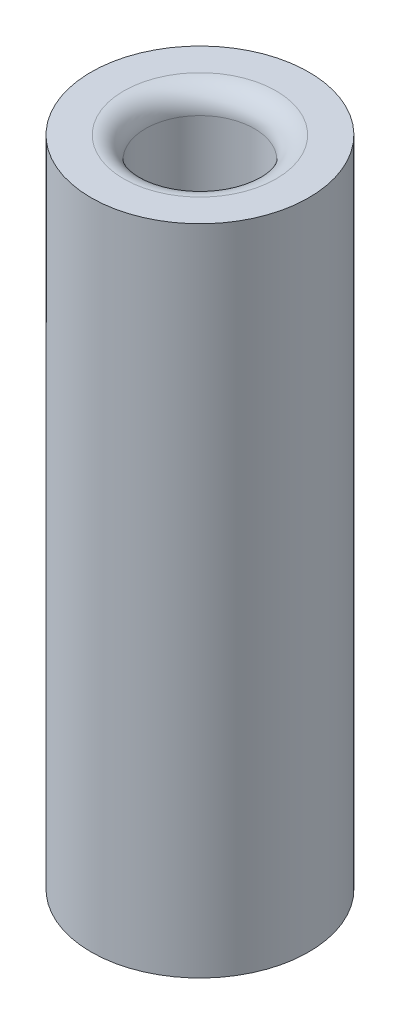
from build123d import *

# Parameters (mm, degrees)
SKETCH1_R           = 2.5
SKETCH1_R_2         = 1.25
BOSS_EXTRUDE1_DEPTH = 15
FILLET1_R           = 0.5


with BuildPart() as part:
    # Sketch1 → Boss-Extrude1 (new body)
    with BuildSketch(Plane(origin=(0, 0, 0), x_dir=(1, 0, 0), z_dir=(0, 1, 0))):
        with Locations(Location((0, 0, 0), (0, 0, 270))):
            Circle(SKETCH1_R)
        with Locations(Location((0, 0, 0), (0, 0, 270))):
            Circle(SKETCH1_R_2, mode=Mode.SUBTRACT)
    extrude(amount=BOSS_EXTRUDE1_DEPTH)

    # Fillet1
    fillet1_edges = [part.edges().sort_by_distance(p)[0] for p in [
        (0, 0, -1.25),
        (0, 15, -1.25),
    ]]
    fillet(fillet1_edges, radius=FILLET1_R)


solid = part.part
